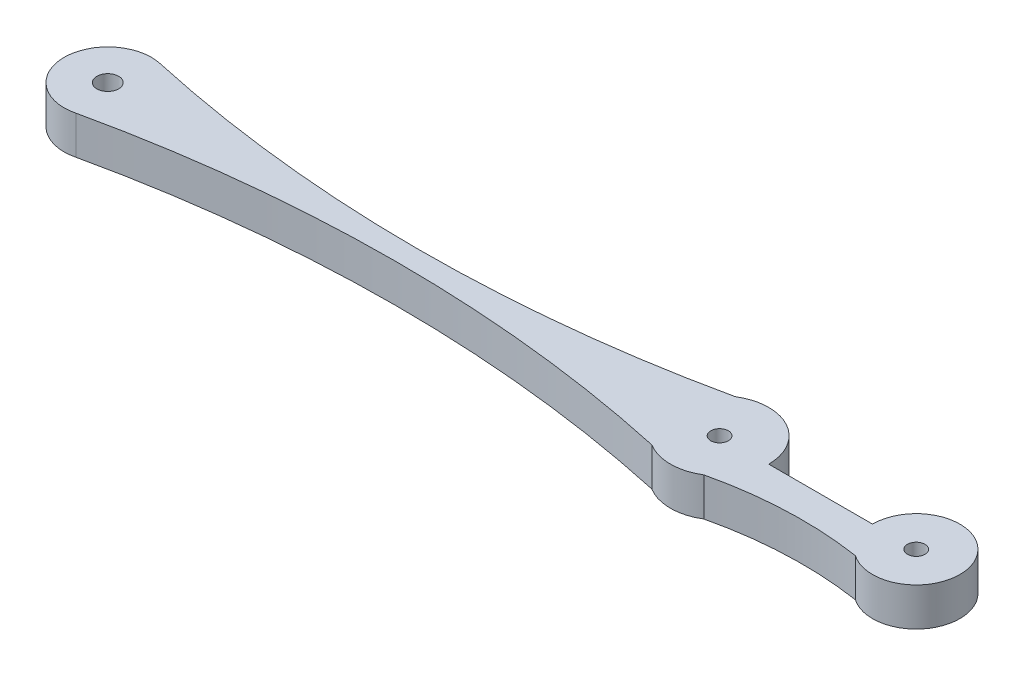
from build123d import *

# Parameters (mm, degrees)
SKETCH1_R           = 2
SKETCH1_R_2         = 1.6
BOSS_EXTRUDE1_DEPTH = 7
SKETCH4_R           = 1.6
CUT_EXTRUDE1_DEPTH  = 10


with BuildPart() as part:
    # Sketch1 → Boss-Extrude1 (new body)
    with BuildSketch(Plane(origin=(0, 0, 0), x_dir=(1, 0, 0), z_dir=(0, 1, 0))):
        with BuildLine():
            ThreePointArc((-110.092216302, 7.769193096), (-120, 0), (-110.092216302, -7.769193096))
            ThreePointArc((-110.092216302, -7.769193096), (-57.431509927, -1.988156982), (-4.756803809, -7.640210568))
            ThreePointArc((-4.756803809, -7.640210568), (0, -9), (4.756803809, -7.640210568))
            ThreePointArc((4.756803809, -7.640210568), (18.044616959, -5.824262713), (31.43520243, -6.569826721))
            ThreePointArc((31.43520243, -6.569826721), (43.089371642, 3.706859819), (28, 0))
            Line((28, 0), (9, 0))
            ThreePointArc((9, 0), (4.369711988, 7.868012274), (-4.756803809, 7.640210568))
            ThreePointArc((-4.756803809, 7.640210568), (-57.431509927, 1.988156982), (-110.092216302, 7.769193096))
        make_face()
        with Locations(Location((-112, 0, 0), (0, 0, 270))):
            Circle(SKETCH1_R, mode=Mode.SUBTRACT)
        with Locations(Location((36, 0, 0), (0, 0, 270))):
            Circle(SKETCH1_R_2, mode=Mode.SUBTRACT)
    extrude(amount=BOSS_EXTRUDE1_DEPTH)

    # Sketch4 → Cut-Extrude1 (cut)
    with BuildSketch(Plane(origin=(0, 7, 0), x_dir=(1, 0, 0), z_dir=(0, 1, 0))):
        with Locations(Location((0, 0, 0), (0, 0, 270))):
            Circle(SKETCH4_R)
    extrude(amount=-CUT_EXTRUDE1_DEPTH, mode=Mode.SUBTRACT)


solid = part.part
